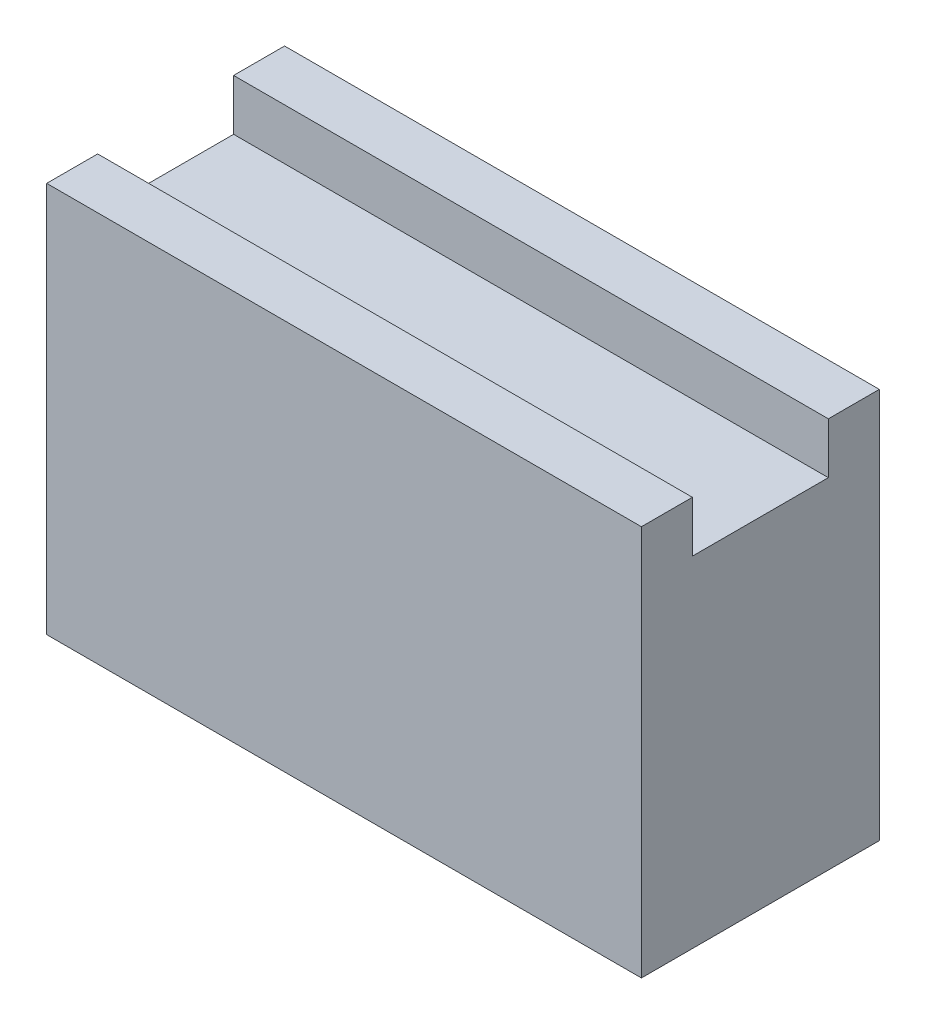
from build123d import *

# Parameters (mm, degrees)
BOSS_EXTRUDE1_DEPTH = 35


with BuildPart() as part:
    # Sketch1 → Boss-Extrude1 (new body)
    with BuildSketch(Plane(origin=(0, 0, 0), x_dir=(0, 0, -1), z_dir=(1, 0, 0))):
        Polygon((-7, 10), (-7, 13), (-4, 13), (-4, 10), (4, 10), (4, 13), (7, 13), (7, 10), (7, -10), (-7, -10), align=None)
    extrude(amount=-BOSS_EXTRUDE1_DEPTH)


solid = part.part
